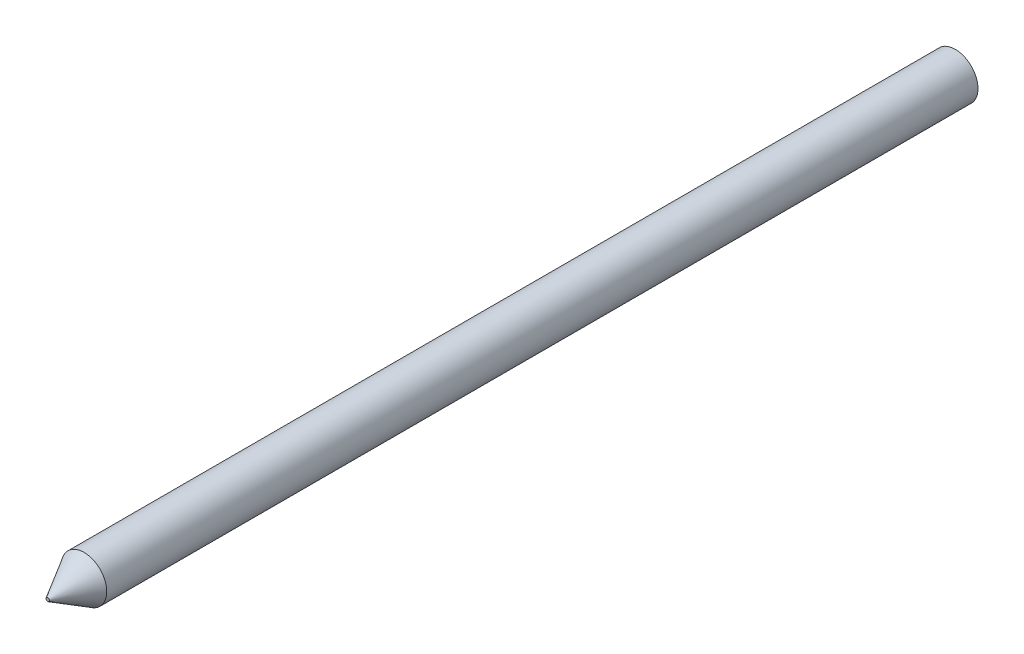
from build123d import *

# Parameters (mm, degrees)
SKETCH1_R           = 6.35
BOSS_EXTRUDE2_DEPTH = 254
CHAMFER7_SIZE       = 10.16
CHAMFER7_SIZE2      = 5.865878735


with BuildPart() as part:
    # Sketch1 → Boss-Extrude2 (new body)
    with BuildSketch(Plane.XY):
        with Locations((-59.467411181, 37.124164206)):
            Circle(SKETCH1_R)
    extrude(amount=BOSS_EXTRUDE2_DEPTH)

    # Chamfer7
    chamfer7_edges = [part.edges().sort_by_distance(p)[0] for p in [
        (-65.817411181, 37.124164206, 254),
    ]]
    chamfer7_side = [part.faces().sort_by_distance(p)[0] for p in [
        (-65.817411181, 37.124164206, 127),
    ]]
    chamfer(chamfer7_edges, length=CHAMFER7_SIZE, length2=CHAMFER7_SIZE2, reference=chamfer7_side[0])


solid = part.part
